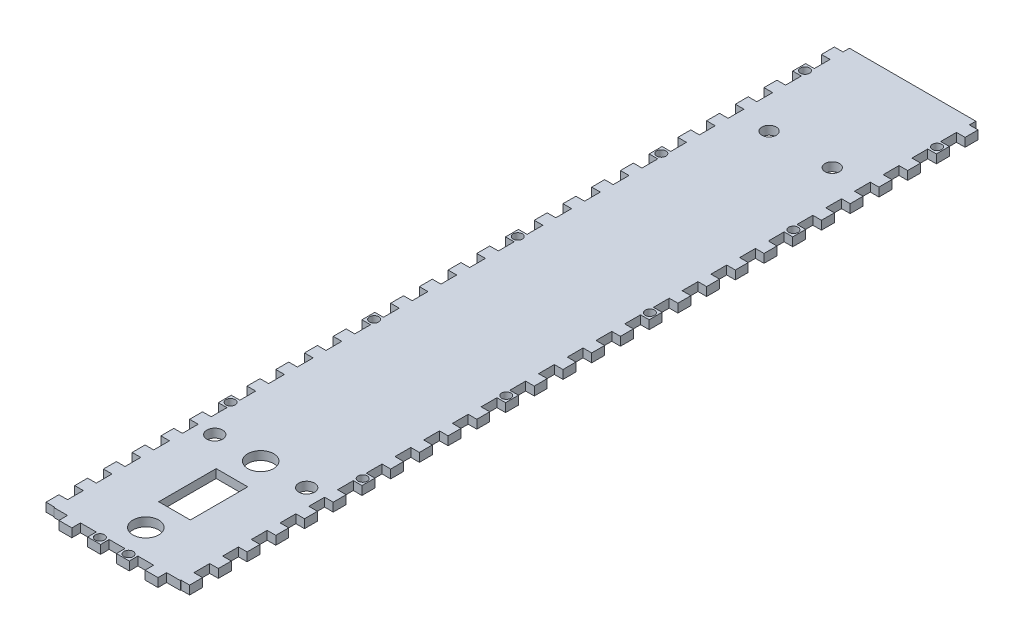
from build123d import *

# Parameters (mm, degrees)
SKETCH1_W             = 44
SKETCH1_H             = 3
BOSS_EXTRUDE1_DEPTH   = 277
SKETCH4_W             = 4.5
SKETCH4_H             = 3
BOSS_EXTRUDE2_DEPTH   = 3
SKETCH5_W             = 4.5
SKETCH5_H             = 3
BOSS_EXTRUDE3_DEPTH   = 3
SKETCH6_W             = 4.5
SKETCH6_H             = 3
BOSS_EXTRUDE4_DEPTH   = 3
SKETCH7_R             = 1.6
CUT_EXTRUDE1_DEPTH    = 3
SKETCH8_R             = 2.5
CUT_EXTRUDE2_DEPTH    = 12
SKETCH9_R             = 1.6
CUT_EXTRUDE3_DEPTH    = 12
SKETCH11_R            = 4.5
SKETCH11_R_2          = 2.75
SKETCH11_W            = 11
SKETCH11_H            = 20
CUT_EXTRUDE4_DEPTH    = 282.956246282
SKETCH7_2_R           = 1.6
BOSS_EXTRUDE5_DEPTH   = 3
BOSS_EXTRUDE5_2_DEPTH = 3


with BuildPart() as part:
    # Sketch1 → Boss-Extrude1 (new body)
    with BuildSketch(Plane.XY):
        with Locations((-8.02006689, 9.02173913)):
            Rectangle(SKETCH1_W, SKETCH1_H)
    extrude(amount=BOSS_EXTRUDE1_DEPTH)

    # Sketch4 → Boss-Extrude2 (add)
    with BuildSketch(Plane(origin=(13.97993311, 0, 0), x_dir=(0, 0, -1), z_dir=(1, 0, 0))):
        with Locations((-274.5, 9.02173913)):
            Rectangle(SKETCH4_W, SKETCH4_H)
        with Locations((-264.5, 9.02173913)):
            Rectangle(SKETCH4_W, SKETCH4_H)
        with Locations((-254.5, 9.02173913)):
            Rectangle(SKETCH4_W, SKETCH4_H)
        with Locations((-244.5, 9.02173913)):
            Rectangle(SKETCH4_W, SKETCH4_H)
        with Locations((-234.5, 9.02173913)):
            Rectangle(SKETCH4_W, SKETCH4_H)
        with Locations((-224.5, 9.02173913)):
            Rectangle(SKETCH4_W, SKETCH4_H)
        with Locations((-214.5, 9.02173913)):
            Rectangle(SKETCH4_W, SKETCH4_H)
        with Locations((-204.5, 9.02173913)):
            Rectangle(SKETCH4_W, SKETCH4_H)
        with Locations((-194.5, 9.02173913)):
            Rectangle(SKETCH4_W, SKETCH4_H)
        with Locations((-184.5, 9.02173913)):
            Rectangle(SKETCH4_W, SKETCH4_H)
        with Locations((-174.5, 9.02173913)):
            Rectangle(SKETCH4_W, SKETCH4_H)
        with Locations((-164.5, 9.02173913)):
            Rectangle(SKETCH4_W, SKETCH4_H)
        with Locations((-154.5, 9.02173913)):
            Rectangle(SKETCH4_W, SKETCH4_H)
        with Locations((-144.5, 9.02173913)):
            Rectangle(SKETCH4_W, SKETCH4_H)
        with Locations((-134.5, 9.02173913)):
            Rectangle(SKETCH4_W, SKETCH4_H)
        with Locations((-124.5, 9.02173913)):
            Rectangle(SKETCH4_W, SKETCH4_H)
        with Locations((-114.5, 9.02173913)):
            Rectangle(SKETCH4_W, SKETCH4_H)
        with Locations((-104.5, 9.02173913)):
            Rectangle(SKETCH4_W, SKETCH4_H)
        with Locations((-94.5, 9.02173913)):
            Rectangle(SKETCH4_W, SKETCH4_H)
        with Locations((-84.5, 9.02173913)):
            Rectangle(SKETCH4_W, SKETCH4_H)
        with Locations((-74.5, 9.02173913)):
            Rectangle(SKETCH4_W, SKETCH4_H)
        with Locations((-64.5, 9.02173913)):
            Rectangle(SKETCH4_W, SKETCH4_H)
        with Locations((-54.5, 9.02173913)):
            Rectangle(SKETCH4_W, SKETCH4_H)
        with Locations((-44.5, 9.02173913)):
            Rectangle(SKETCH4_W, SKETCH4_H)
        with Locations((-34.5, 9.02173913)):
            Rectangle(SKETCH4_W, SKETCH4_H)
        with Locations((-24.5, 9.02173913)):
            Rectangle(SKETCH4_W, SKETCH4_H)
        with Locations((-14.5, 9.02173913)):
            Rectangle(SKETCH4_W, SKETCH4_H)
        with Locations((-4.5, 9.02173913)):
            Rectangle(SKETCH4_W, SKETCH4_H)
    extrude(amount=BOSS_EXTRUDE2_DEPTH)

    # Sketch5 → Boss-Extrude3 (add)
    with BuildSketch(Plane.ZY.offset(30.02006689)):
        with Locations((274.5, 9.02173913)):
            Rectangle(SKETCH5_W, SKETCH5_H)
        with Locations((264.5, 9.02173913)):
            Rectangle(SKETCH5_W, SKETCH5_H)
        with Locations((254.5, 9.02173913)):
            Rectangle(SKETCH5_W, SKETCH5_H)
        with Locations((244.5, 9.02173913)):
            Rectangle(SKETCH5_W, SKETCH5_H)
        with Locations((234.5, 9.02173913)):
            Rectangle(SKETCH5_W, SKETCH5_H)
        with Locations((224.5, 9.02173913)):
            Rectangle(SKETCH5_W, SKETCH5_H)
        with Locations((214.5, 9.02173913)):
            Rectangle(SKETCH5_W, SKETCH5_H)
        with Locations((204.5, 9.02173913)):
            Rectangle(SKETCH5_W, SKETCH5_H)
        with Locations((194.5, 9.02173913)):
            Rectangle(SKETCH5_W, SKETCH5_H)
        with Locations((184.5, 9.02173913)):
            Rectangle(SKETCH5_W, SKETCH5_H)
        with Locations((174.5, 9.02173913)):
            Rectangle(SKETCH5_W, SKETCH5_H)
        with Locations((164.5, 9.02173913)):
            Rectangle(SKETCH5_W, SKETCH5_H)
        with Locations((154.5, 9.02173913)):
            Rectangle(SKETCH5_W, SKETCH5_H)
        with Locations((144.5, 9.02173913)):
            Rectangle(SKETCH5_W, SKETCH5_H)
        with Locations((134.5, 9.02173913)):
            Rectangle(SKETCH5_W, SKETCH5_H)
        with Locations((124.5, 9.02173913)):
            Rectangle(SKETCH5_W, SKETCH5_H)
        with Locations((114.5, 9.02173913)):
            Rectangle(SKETCH5_W, SKETCH5_H)
        with Locations((104.5, 9.02173913)):
            Rectangle(SKETCH5_W, SKETCH5_H)
        with Locations((94.5, 9.02173913)):
            Rectangle(SKETCH5_W, SKETCH5_H)
        with Locations((84.5, 9.02173913)):
            Rectangle(SKETCH5_W, SKETCH5_H)
        with Locations((74.5, 9.02173913)):
            Rectangle(SKETCH5_W, SKETCH5_H)
        with Locations((64.5, 9.02173913)):
            Rectangle(SKETCH5_W, SKETCH5_H)
        with Locations((54.5, 9.02173913)):
            Rectangle(SKETCH5_W, SKETCH5_H)
        with Locations((44.5, 9.02173913)):
            Rectangle(SKETCH5_W, SKETCH5_H)
        with Locations((34.5, 9.02173913)):
            Rectangle(SKETCH5_W, SKETCH5_H)
        with Locations((24.5, 9.02173913)):
            Rectangle(SKETCH5_W, SKETCH5_H)
        with Locations((14.5, 9.02173913)):
            Rectangle(SKETCH5_W, SKETCH5_H)
        with Locations((4.5, 9.02173913)):
            Rectangle(SKETCH5_W, SKETCH5_H)
    extrude(amount=BOSS_EXTRUDE3_DEPTH)

    # Sketch6 → Boss-Extrude4 (add)
    with BuildSketch(Plane.XY.offset(277)):
        with Locations((-23.02006689, 9.02173913)):
            Rectangle(SKETCH6_W, SKETCH6_H)
        with Locations((-13.02006689, 9.02173913)):
            Rectangle(SKETCH6_W, SKETCH6_H)
        with Locations((-3.02006689, 9.02173913)):
            Rectangle(SKETCH6_W, SKETCH6_H)
        with Locations((6.97993311, 9.02173913)):
            Rectangle(SKETCH6_W, SKETCH6_H)
    extrude(amount=BOSS_EXTRUDE4_DEPTH)

    # Sketch7 → Cut-Extrude1 (cut)
    with BuildSketch(Plane.XZ.offset(-7.52173913)):
        with Locations(Location((14.97993311, 264.5, 0), (0, 0, 270))):
            Circle(SKETCH7_R)
        with Locations(Location((-31.02006689, 264.5, 0), (0, 0, 90))):
            Circle(SKETCH7_R)
        with Locations(Location((-31.02006689, 214.5, 0), (0, 0, 90))):
            Circle(SKETCH7_R)
        with Locations(Location((14.97993311, 214.5, 0), (0, 0, 270))):
            Circle(SKETCH7_R)
        with Locations(Location((-31.02006689, 164.5, 0), (0, 0, 90))):
            Circle(SKETCH7_R)
        with Locations(Location((14.97993311, 164.5, 0), (0, 0, 270))):
            Circle(SKETCH7_R)
        with Locations(Location((-31.02006689, 114.5, 0), (0, 0, 90))):
            Circle(SKETCH7_R)
        with Locations(Location((14.97993311, 114.5, 0), (0, 0, 270))):
            Circle(SKETCH7_R)
        with Locations(Location((-31.02006689, 64.5, 0), (0, 0, 90))):
            Circle(SKETCH7_R)
        with Locations(Location((14.97993311, 64.5, 0), (0, 0, 270))):
            Circle(SKETCH7_R)
        with Locations(Location((-31.02006689, 14.5, 0), (0, 0, 90))):
            Circle(SKETCH7_R)
        with Locations(Location((14.97993311, 14.5, 0), (0, 0, 270))):
            Circle(SKETCH7_R)
    extrude(amount=-CUT_EXTRUDE1_DEPTH, mode=Mode.SUBTRACT)

    # Sketch8 → Cut-Extrude2 (cut)
    with BuildSketch(Plane.XZ.offset(-7.52173913)):
        with Locations(Location((-19.02006689, 39, 0), (0, 0, 270))):
            Circle(SKETCH8_R)
        with Locations(Location((2.97993311, 39, 0), (0, 0, 270))):
            Circle(SKETCH8_R)
    extrude(amount=-CUT_EXTRUDE2_DEPTH, mode=Mode.SUBTRACT)

    # Sketch9 → Cut-Extrude3 (cut)
    with BuildSketch(Plane(origin=(0, 7.52173913, 0), x_dir=(-1, 0, 0), z_dir=(0, -1, 0))):
        with Locations(Location((13.02006689, -278, 0), (0, 0, 90))):
            Circle(SKETCH9_R)
        with Locations(Location((3.02006689, -278, 0), (0, 0, 90))):
            Circle(SKETCH9_R)
    extrude(amount=-CUT_EXTRUDE3_DEPTH, mode=Mode.SUBTRACT)

    # Sketch11 → Cut-Extrude4 (cut, through all)
    with BuildSketch(Plane.XZ.offset(-7.52173913)):
        with Locations(Location((-8.02006689, 267, 0), (0, 0, 270))):
            Circle(SKETCH11_R)
        with Locations(Location((-8.02006689, 227, 0), (0, 0, 270))):
            Circle(SKETCH11_R)
        with Locations(Location((-24.02006689, 227, 0), (0, 0, 270))):
            Circle(SKETCH11_R_2)
        with Locations(Location((7.97993311, 227, 0), (0, 0, 270))):
            Circle(SKETCH11_R_2)
        with Locations((-8.02006689, 247)):
            Rectangle(SKETCH11_W, SKETCH11_H)
    extrude(amount=-CUT_EXTRUDE4_DEPTH, mode=Mode.SUBTRACT)


with BuildPart() as body_2:
    # Sketch7<2> → Boss-Extrude5 (new, through all)
    with BuildSketch(Plane.XZ.offset(-7.52173913)):
        with Locations(Location((14.97993311, 264.5, 0), (0, 0, 270))):
            Circle(SKETCH7_2_R)
    extrude(amount=-BOSS_EXTRUDE5_DEPTH)


with BuildPart() as body_3:
    # Sketch7<2> → Boss-Extrude5 2 (new, through all)
    with BuildSketch(Plane.XZ.offset(-7.52173913)):
        with Locations(Location((-31.02006689, 264.5, 0), (0, 0, 270))):
            Circle(SKETCH7_2_R)
    extrude(amount=-BOSS_EXTRUDE5_2_DEPTH)


with BuildPart() as part_1:
    add(part.part)

    # Combine1: union body 3, body 2
    add(body_3.part)
    add(body_2.part)


solid = part_1.part
